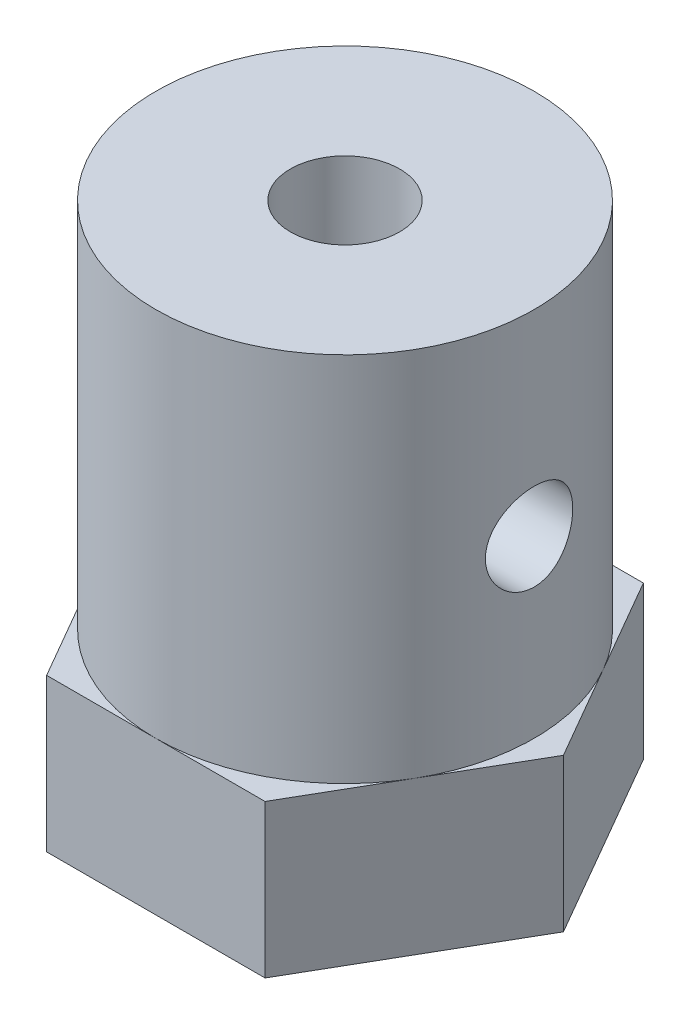
from build123d import *

# Parameters (mm, degrees)
EXTRUDE_1_DEPTH          = 7
SKETCH_5_R               = 8.660254038
SKETCH_5_R_2             = 2.5
EXTRUDE_2_DEPTH          = 17
SKETCH_2_R               = 2
CUT_EXTRUDE_4_DEPTH      = 7
CUT_EXTRUDE_5_DEPTH      = 28.404379212
CUT_EXTRUDE_5_DEPTH_BACK = 28.404379212
SKETCH_6_R               = 2


with BuildPart() as part:
    # 草图1 → 凸台-拉伸1 (new body)
    with BuildSketch(Plane(origin=(0, 0, 0), x_dir=(1, 0, 0), z_dir=(0, 1, 0))):
        Polygon((10, 0), (5, 8.660254038), (-5, 8.660254038), (-10, 0), (-5, -8.660254038), (5, -8.660254038), align=None)
    extrude(amount=EXTRUDE_1_DEPTH)

    # 草图5 → 凸台-拉伸2 (add)
    with BuildSketch(Plane(origin=(0, 7, 0), x_dir=(1, 0, 0), z_dir=(0, 1, 0))):
        with Locations(Location((0, 0, 0), (0, 0, 270))):
            Circle(SKETCH_5_R)
        with Locations(Location((0, 0, 0), (0, 0, 270))):
            Circle(SKETCH_5_R_2, mode=Mode.SUBTRACT)
    extrude(amount=EXTRUDE_2_DEPTH)

    # 草图2 → 切除-拉伸4 (cut)
    with BuildSketch(Plane.XZ):
        with Locations(Location((0, 0, 0), (0, 0, 270))):
            Circle(SKETCH_2_R)
        with Locations(Location((-5, 2.886751346, 0), (0, 0, 270))):
            Circle(SKETCH_2_R)
        with Locations(Location((5, 2.886751346, 0), (0, 0, 270))):
            Circle(SKETCH_2_R)
        with Locations(Location((0, -5.773502692, 0), (0, 0, 270))):
            Circle(SKETCH_2_R)
    extrude(amount=-CUT_EXTRUDE_4_DEPTH, mode=Mode.SUBTRACT)

    # 草图6 → 切除-拉伸5 (cut, two sides: drawn at the far end of the back side and taken through both)
    with BuildSketch(Plane(origin=(0, 0, 0), x_dir=(0, 0, -1), z_dir=(1, 0, 0)).offset(-CUT_EXTRUDE_5_DEPTH_BACK)):
        with Locations((0, 15)):
            Circle(SKETCH_6_R)
    extrude(amount=CUT_EXTRUDE_5_DEPTH + CUT_EXTRUDE_5_DEPTH_BACK, mode=Mode.SUBTRACT)


solid = part.part
